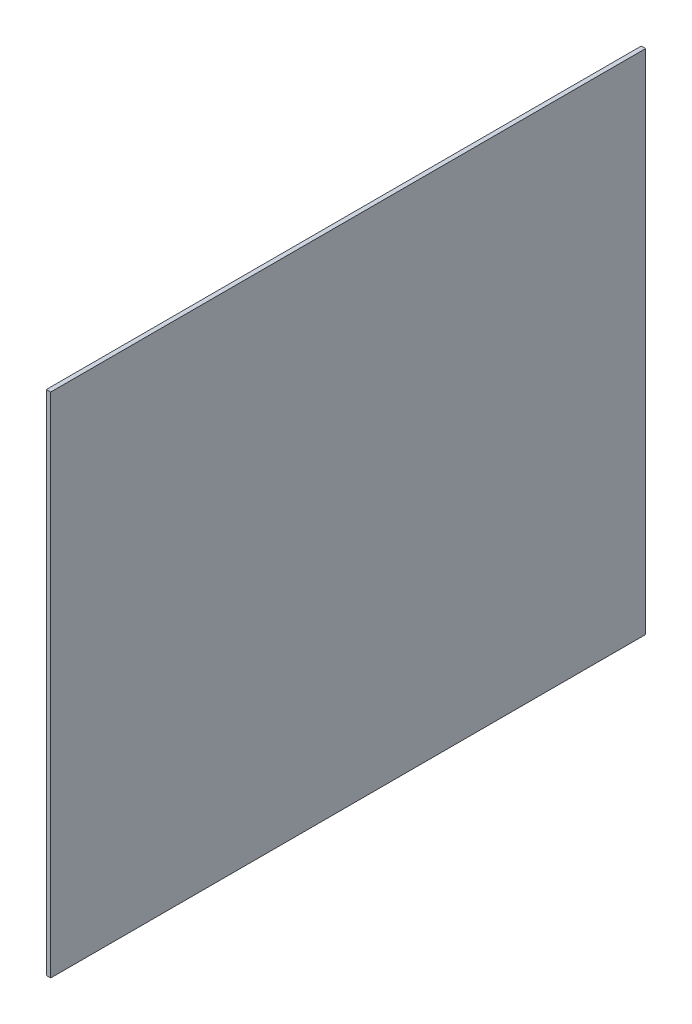
from build123d import *

# Parameters (mm, degrees)
SKETCH1_W           = 3.175
SKETCH1_H           = 368.3
BOSS_EXTRUDE1_DEPTH = 431.8


with BuildPart() as part:
    # Sketch1 → Boss-Extrude1 (new body)
    with BuildSketch(Plane.XY):
        Rectangle(SKETCH1_W, SKETCH1_H)
    extrude(amount=BOSS_EXTRUDE1_DEPTH)


solid = part.part
